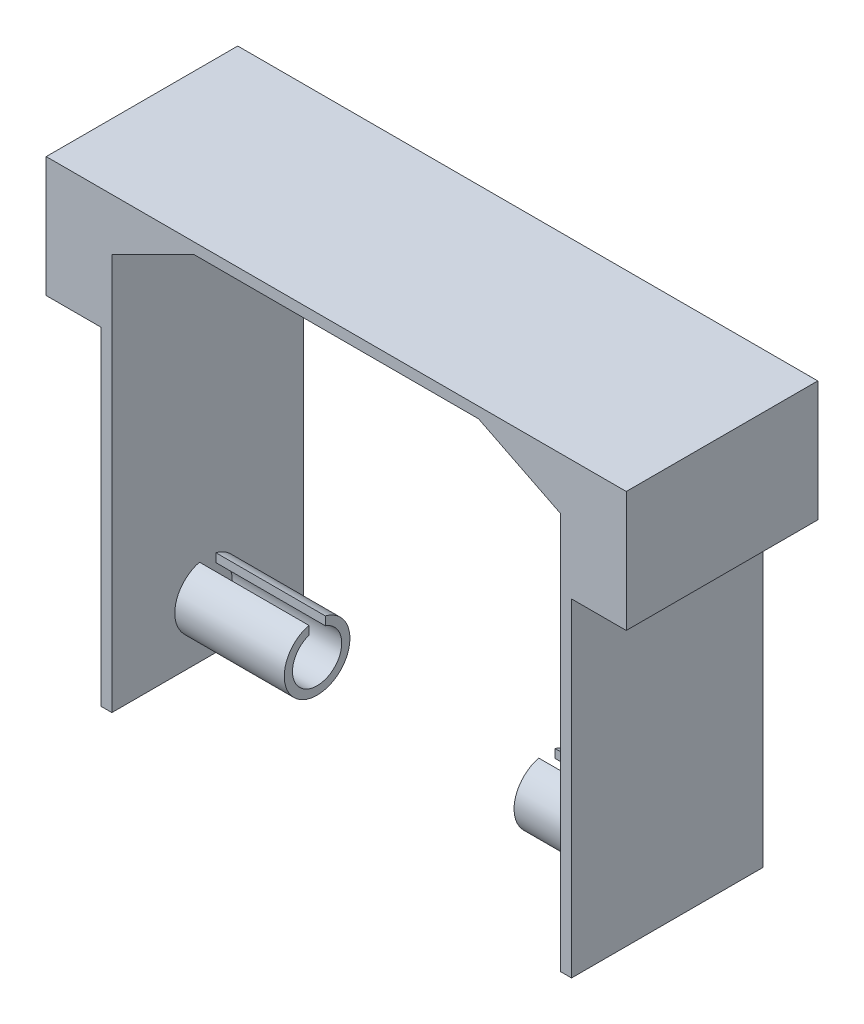
from build123d import *

# Parameters (mm, degrees)
SALIENTE_EXTRUIR1_DEPTH  = 40
SALIENTE_EXTRUIR2_DEPTH  = 4
CROQUIS3_W               = 70
CROQUIS3_H               = 40
SALIENTE_EXTRUIR3_DEPTH  = 20
SALIENTE_EXTRUIR4_START  = 140
CROQUIS5_W               = 164
CROQUIS5_H               = 70
SALIENTE_EXTRUIR4_DEPTH  = 4
SALIENTE_EXTRUIR5_START  = 164
CROQUIS7_W               = 70
CROQUIS7_H               = 160
SALIENTE_EXTRUIR5_DEPTH  = 4
CROQUIS8_W               = 70
CROQUIS8_H               = 40
SALIENTE_EXTRUIR6_DEPTH  = 20
SALIENTE_EXTRUIR12_DEPTH = 4
CROQUIS11_W              = 24
CROQUIS11_H              = 70
SALIENTE_EXTRUIR13_DEPTH = 4
SALIENTE_EXTRUIR14_START = 40
SALIENTE_EXTRUIR14_DEPTH = 40
SALIENTE_EXTRUIR15_START = 25
SALIENTE_EXTRUIR15_DEPTH = 10
SALIENTE_EXTRUIR16_START = -25
SALIENTE_EXTRUIR16_DEPTH = 10


with BuildPart() as part:
    # Croquis1 → Saliente-Extruir1 (new body)
    with BuildSketch(Plane(origin=(0, 0, 0), x_dir=(0, 0, -1), z_dir=(1, 0, 0))):
        with BuildLine():
            Line((-3, 11.618950039), (-3, 8.485281374))
            ThreePointArc((-3, 8.485281374), (0, -9), (3, 8.485281374))
            Line((3, 8.485281374), (3, 11.618950039))
            ThreePointArc((3, 11.618950039), (0, -12), (-3, 11.618950039))
        make_face()
    extrude(amount=SALIENTE_EXTRUIR1_DEPTH)

    # Croquis2 → Saliente-Extruir2 (add)
    with BuildSketch(Plane.ZY):
        Polygon((-35, 0), (-35, -20), (35, -20), (35, 0), (35, 140), (-35, 140), align=None)
    extrude(amount=SALIENTE_EXTRUIR2_DEPTH)

    # Croquis3 → Saliente-Extruir3 (add)
    with BuildSketch(Plane.ZY.offset(4)):
        with Locations((0, 120)):
            Rectangle(CROQUIS3_W, CROQUIS3_H)
    extrude(amount=SALIENTE_EXTRUIR3_DEPTH)



with BuildPart() as body_2:
    # Croquis5 → Saliente-Extruir4 (new body)
    with BuildSketch(Plane(origin=(0, 0, 0), x_dir=(1, 0, 0), z_dir=(0, 1, 0)).offset(SALIENTE_EXTRUIR4_START)):
        with Locations((82, 0)):
            Rectangle(CROQUIS5_W, CROQUIS5_H)
    extrude(amount=SALIENTE_EXTRUIR4_DEPTH)



with BuildPart() as body_3:
    # Croquis7 → Saliente-Extruir5 (new body)
    with BuildSketch(Plane(origin=(0, 0, 0), x_dir=(0, 0, -1), z_dir=(1, 0, 0)).offset(SALIENTE_EXTRUIR5_START)):
        with Locations((0, 60)):
            Rectangle(CROQUIS7_W, CROQUIS7_H)
    extrude(amount=SALIENTE_EXTRUIR5_DEPTH)

    # Croquis8 → Saliente-Extruir6 (add)
    with BuildSketch(Plane(origin=(168, 0, 0), x_dir=(0, 0, -1), z_dir=(1, 0, 0))):
        with Locations((0, 120)):
            Rectangle(CROQUIS8_W, CROQUIS8_H)
    extrude(amount=SALIENTE_EXTRUIR6_DEPTH)


with BuildPart() as body_2_1:
    add(body_2.part)

    add(body_3.part)  # Saliente-Extruir12 merges body 3
    # Croquis10 → Saliente-Extruir12 (add)
    with BuildSketch(Plane(origin=(0, 140, 0), x_dir=(1, 0, 0), z_dir=(0, 1, 0))):
        Polygon((188, 25), (188, -25), (188, -35), (164, -35), (164, -25), (164, 25), (164, 35), (188, 35), align=None)
    extrude(amount=SALIENTE_EXTRUIR12_DEPTH)


with BuildPart() as part_1:
    add(part.part)

    add(body_2_1.part)  # Saliente-Extruir13 merges body 2
    # Croquis11 → Saliente-Extruir13 (add)
    with BuildSketch(Plane(origin=(0, 140, 0), x_dir=(1, 0, 0), z_dir=(0, 1, 0))):
        with Locations((-12, 0)):
            Rectangle(CROQUIS11_W, CROQUIS11_H)
    extrude(amount=SALIENTE_EXTRUIR13_DEPTH)

    # Croquis12 → Saliente-Extruir14 (add)
    with BuildSketch(Plane.ZY.offset(-164).offset(SALIENTE_EXTRUIR14_START)):
        with BuildLine():
            Line((0, -9), (0, -12))
            ThreePointArc((0, -12), (11.904356355, -1.51205151), (3, 11.618950039))
            Line((3, 11.618950039), (3, 8.485281374))
            ThreePointArc((3, 8.485281374), (8.870387037, -1.521917809), (0, -9))
        make_face()
        with BuildLine():
            ThreePointArc((-3, 11.618950039), (-11.904356355, -1.51205151), (0, -12))
            Line((0, -12), (0, -9))
            ThreePointArc((0, -9), (-8.870387037, -1.521917809), (-3, 8.485281374))
            Line((-3, 8.485281374), (-3, 11.618950039))
        make_face()
    extrude(amount=-SALIENTE_EXTRUIR14_DEPTH)

    # Croquis13 → Saliente-Extruir15 (add)
    with BuildSketch(Plane.XY.offset(SALIENTE_EXTRUIR15_START)):
        Polygon((164, 140), (134, 140), (164, 125), align=None)
        Polygon((0, 140), (30, 140), (0, 125), align=None)
    extrude(amount=SALIENTE_EXTRUIR15_DEPTH)

    # Croquis14 → Saliente-Extruir16 (add)
    with BuildSketch(Plane.XY.offset(SALIENTE_EXTRUIR16_START)):
        Polygon((164, 140), (134, 140), (164, 125), align=None)
        Polygon((0, 140), (30, 140), (0, 125), align=None)
    extrude(amount=-SALIENTE_EXTRUIR16_DEPTH)


solid = part_1.part
